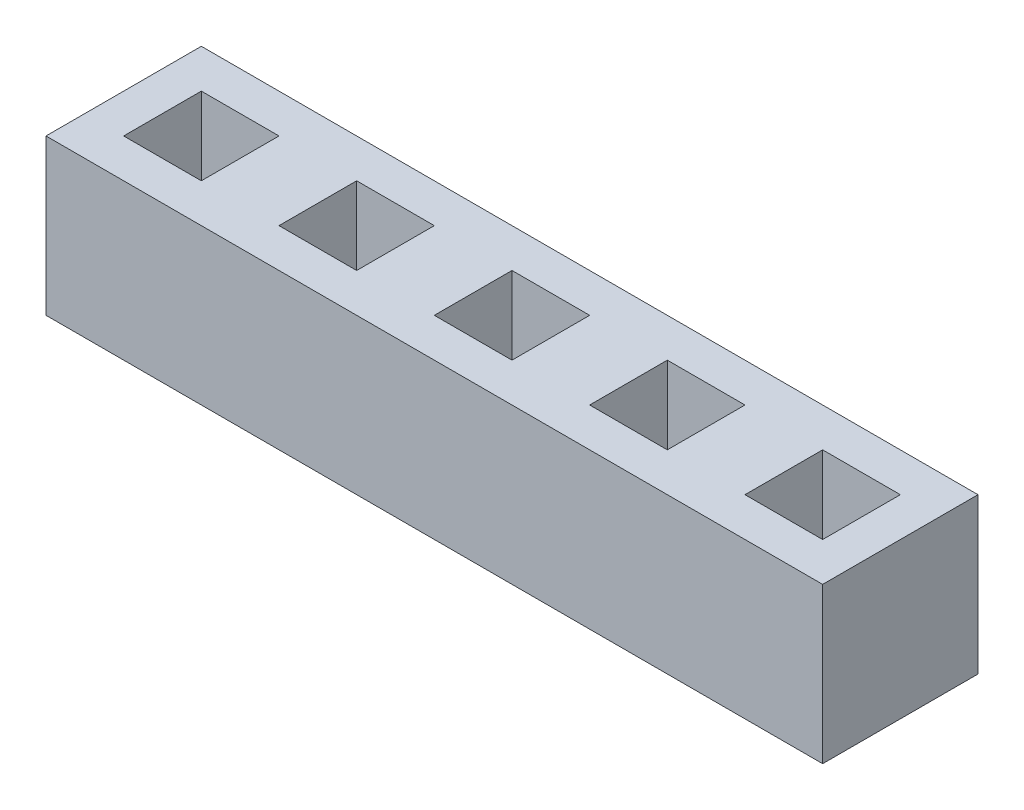
from build123d import *

# Parameters (mm, degrees)
SKETCH1_W           = 12.7
SKETCH1_H           = 2.54
SKETCH1_W_2         = 1.27
SKETCH1_H_2         = 1.27
BOSS_EXTRUDE1_DEPTH = 2.54


with BuildPart() as part:
    # Sketch1 → Boss-Extrude1 (new body)
    with BuildSketch(Plane(origin=(0, 0, 0), x_dir=(1, 0, 0), z_dir=(0, 1, 0))):
        with Locations((6.35, 1.27)):
            Rectangle(SKETCH1_W, SKETCH1_H)
        with Locations((3.81, 1.27)):
            Rectangle(SKETCH1_W_2, SKETCH1_H_2, mode=Mode.SUBTRACT)
        with Locations((1.27, 1.27)):
            Rectangle(SKETCH1_W_2, SKETCH1_H_2, mode=Mode.SUBTRACT)
        with Locations((6.35, 1.27)):
            Rectangle(SKETCH1_W_2, SKETCH1_H_2, mode=Mode.SUBTRACT)
        with Locations((8.89, 1.27)):
            Rectangle(SKETCH1_W_2, SKETCH1_H_2, mode=Mode.SUBTRACT)
        with Locations((11.43, 1.27)):
            Rectangle(SKETCH1_W_2, SKETCH1_H_2, mode=Mode.SUBTRACT)
    extrude(amount=BOSS_EXTRUDE1_DEPTH)


solid = part.part
